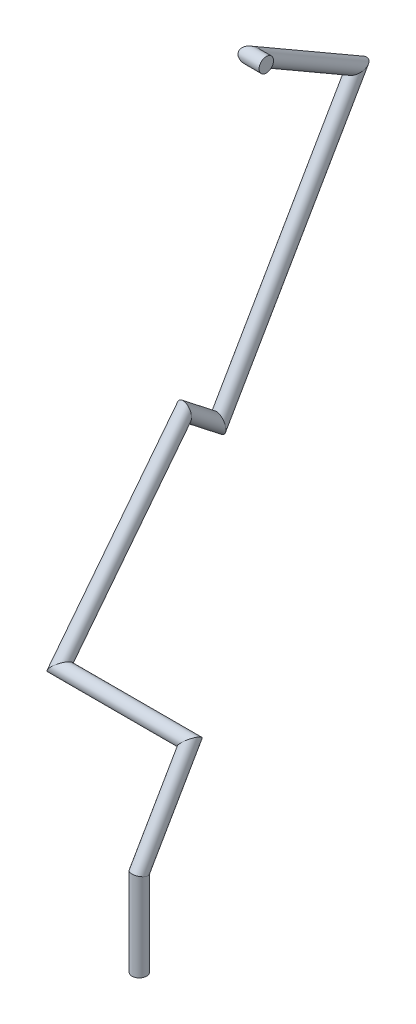
from build123d import *

# Parameters (mm, degrees)
SWEEP1_PROFILE_R = 2.5


with BuildPart() as part:
    # Sweep1: sweep along a curve in space
    with BuildLine() as sweep1_path:
        Line((0, 0, 0), (0, 30, 0))
        Line((0, 30, 0), (0, 60.310889132, -17.5))
        Line((0, 60.310889132, -17.5), (-45, 60.310889132, -17.5))
        Line((-45, 60.310889132, -17.5), (-45, 115.471641885, -60.596303273))
        Line((-45, 115.471641885, -60.596303273), (-45, 106.236719755, -72.416464577))
        Line((-45, 106.236719755, -72.416464577), (-45, 189.375158518, -120.416464577))
        Line((-45, 189.375158518, -120.416464577), (-45, 210.375158518, -84.043397618))
        Line((-45, 210.375158518, -84.043397618), (-40, 210.375158518, -84.043397618))
    # Sweep1 profile (on start of the path) → Sweep1 (sweep)
    with BuildSketch(Plane.ZX):
        Circle(SWEEP1_PROFILE_R)
    sweep(path=sweep1_path.line, transition=Transition.RIGHT)


solid = part.part
